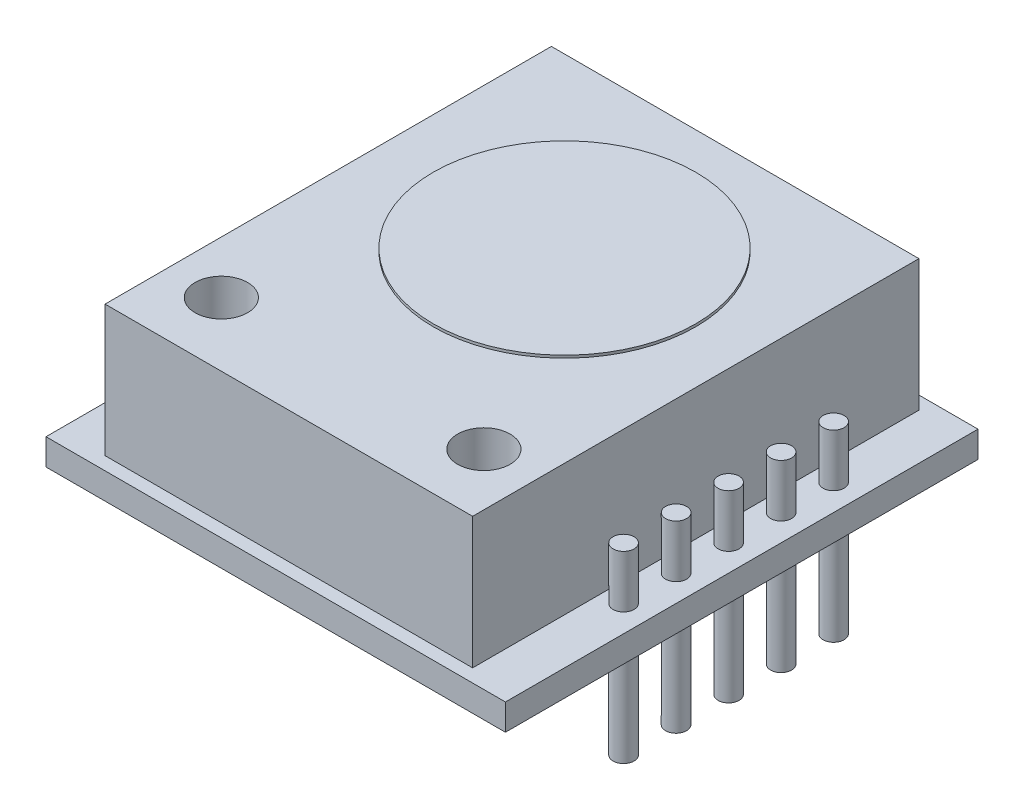
from build123d import *

# Parameters (mm, degrees)
SKETCH1_W                = 17.5
SKETCH1_H                = 18
SKETCH1_R                = 0.4
BOSS_EXTRUDE1_DEPTH      = 1
SKETCH3_W                = 14
SKETCH3_H                = 17
SKETCH3_R                = 1
BOSS_EXTRUDE2_DEPTH      = 5
BOSS_EXTRUDE3_DEPTH      = 2
BOSS_EXTRUDE3_DEPTH_BACK = 5
SKETCH4_R                = 0.4
SKETCH5_R                = 5
BOSS_EXTRUDE4_DEPTH      = 0.1


with BuildPart() as part:
    # Sketch1 → Boss-Extrude1 (new body)
    with BuildSketch(Plane(origin=(0, 0, 0), x_dir=(1, 0, 0), z_dir=(0, 1, 0))):
        Rectangle(SKETCH1_W, SKETCH1_H)
        with Locations(Location((-7.95, -5.1, 0), (0, 0, 270))):
            Circle(SKETCH1_R, mode=Mode.SUBTRACT)
        with Locations(Location((-7.95, -3.1, 0), (0, 0, 270))):
            Circle(SKETCH1_R, mode=Mode.SUBTRACT)
        with Locations(Location((-7.95, -1.1, 0), (0, 0, 270))):
            Circle(SKETCH1_R, mode=Mode.SUBTRACT)
        with Locations(Location((-7.95, 0.9, 0), (0, 0, 270))):
            Circle(SKETCH1_R, mode=Mode.SUBTRACT)
        with Locations(Location((-7.95, 2.9, 0), (0, 0, 270))):
            Circle(SKETCH1_R, mode=Mode.SUBTRACT)
        with Locations(Location((-7.95, 4.9, 0), (0, 0, 270))):
            Circle(SKETCH1_R, mode=Mode.SUBTRACT)
    extrude(amount=BOSS_EXTRUDE1_DEPTH)

    # Sketch3 → Boss-Extrude2 (add)
    with BuildSketch(Plane(origin=(0, 1, 0), x_dir=(1, 0, 0), z_dir=(0, 1, 0))):
        Rectangle(SKETCH3_W, SKETCH3_H)
        with Locations(Location((-5, -6.071428571, 0), (0, 0, 270))):
            Circle(SKETCH3_R, mode=Mode.SUBTRACT)
        with Locations(Location((5, -6.071428571, 0), (0, 0, 270))):
            Circle(SKETCH3_R, mode=Mode.SUBTRACT)
    extrude(amount=BOSS_EXTRUDE2_DEPTH)

    # Sketch4 → Boss-Extrude3 (add, two sides: drawn at the far end of the back side and taken through both)
    with BuildSketch(Plane(origin=(0, 1, 0), x_dir=(1, 0, 0), z_dir=(0, 1, 0)).offset(-BOSS_EXTRUDE3_DEPTH_BACK)):
        with Locations(Location((7.75, 4.5, 0), (0, 0, 270))):
            Circle(SKETCH4_R)
        with Locations(Location((7.75, 2.5, 0), (0, 0, 270))):
            Circle(SKETCH4_R)
        with Locations(Location((7.75, 0.5, 0), (0, 0, 270))):
            Circle(SKETCH4_R)
        with Locations(Location((7.75, -1.5, 0), (0, 0, 270))):
            Circle(SKETCH4_R)
        with Locations(Location((7.75, -3.5, 0), (0, 0, 270))):
            Circle(SKETCH4_R)
    extrude(amount=BOSS_EXTRUDE3_DEPTH + BOSS_EXTRUDE3_DEPTH_BACK)

    # Sketch5 → Boss-Extrude4 (add)
    with BuildSketch(Plane(origin=(0, 6, 0), x_dir=(1, 0, 0), z_dir=(0, 1, 0))):
        with Locations(Location((0, 2, 0), (0, 0, 270))):
            Circle(SKETCH5_R)
    extrude(amount=BOSS_EXTRUDE4_DEPTH)


solid = part.part
